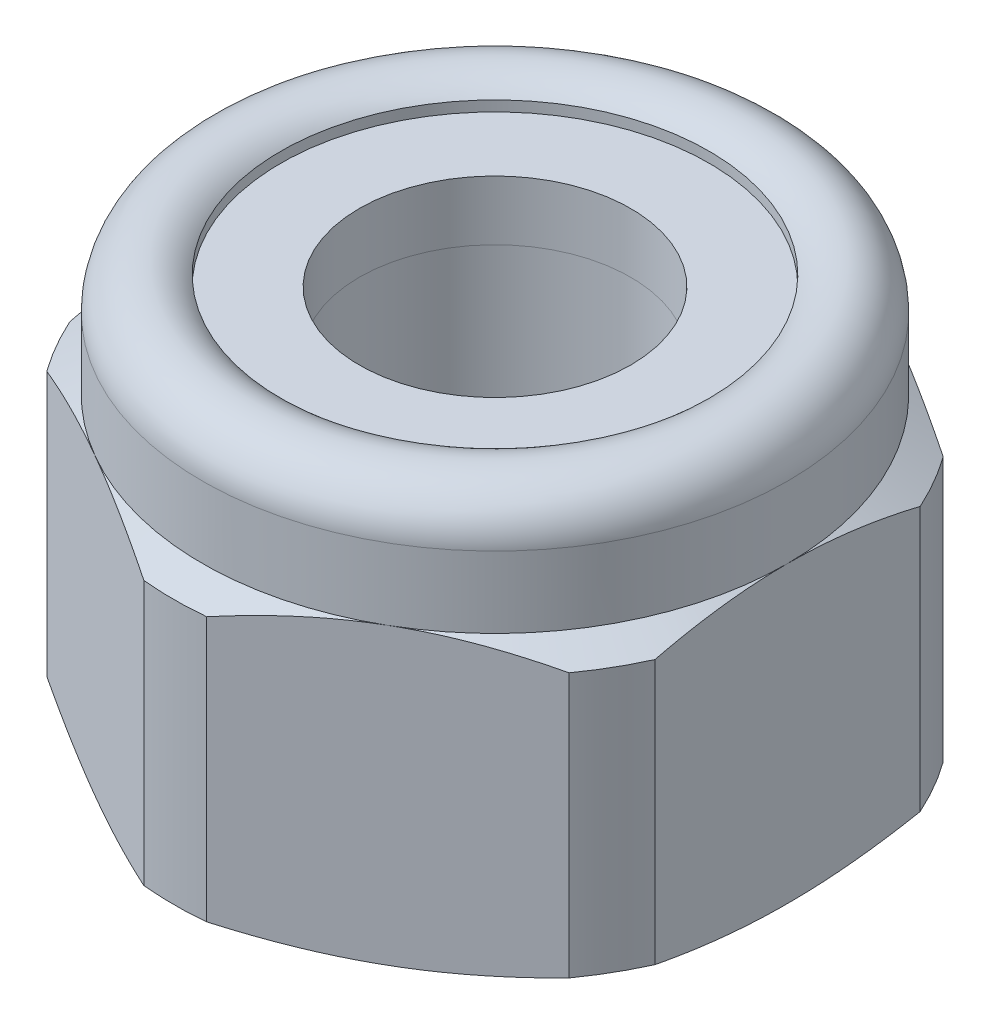
from build123d import *

# Parameters (mm, degrees)
BOSS_EXTRUDE1_DEPTH      = 3.9751
BOSS_EXTRUDE1_DEPTH_BACK = 3.9751
SKETCH2_R                = 2.585793431
SKETCH4_W                = 1.494753284
SKETCH4_H                = 1.134825881
SKETCH11_OUTSIDE_W       = 16.91
SKETCH11_OUTSIDE_H       = 18.636
SKETCH11_OUTSIDE_R       = 6.1214
CUT_EXTRUDE1_DEPTH       = 12.650534115


with BuildPart() as part:
    # Sketch2 → Boss-Extrude1 (new, two sides: drawn at the far end of the back side and taken through both)
    with BuildSketch(Plane(origin=(0, 0, 0), x_dir=(1, 0, 0), z_dir=(0, 1, 0)).offset(-BOSS_EXTRUDE1_DEPTH_BACK)):
        Polygon((0, 6.437801912), (-5.5753, 3.218900956), (-5.5753, -3.218900956), (0, -6.437801912), (5.5753, -3.218900956), (5.5753, 3.218900956), align=None)
        with Locations(Location((0, 0, 0), (0, 0, 270))):
            Circle(SKETCH2_R, mode=Mode.SUBTRACT)
    extrude(amount=BOSS_EXTRUDE1_DEPTH + BOSS_EXTRUDE1_DEPTH_BACK)

    # Sketch3 → Cut-Revolve2 (revolve, cut)
    with BuildSketch(Plane(origin=(0, 0, 0), x_dir=(0, 0, -1), z_dir=(1, 0, 0)), mode=Mode.PRIVATE) as cut_revolve2_sk:
        with BuildLine():
            Line((6.437801912, 1.7399), (6.437801912, 4.9751))
            Line((6.437801912, 4.9751), (2.585793431, 4.9751))
            Line((2.585793431, 4.9751), (2.585793431, 2.38506))
            Line((2.585793431, 2.38506), (4.080546715, 2.38506))
            Line((4.080546715, 2.38506), (4.080546715, 3.718640881))
            ThreePointArc((4.080546715, 3.718640881), (5.034773785, 3.908448447), (5.5753, 3.099493798))
            Line((5.5753, 3.099493798), (5.5753, 1.7399))
            Line((5.5753, 1.7399), (6.437801912, 1.23371655))
            Line((6.437801912, 1.23371655), (6.437801912, 1.7399))
        make_face()
        Polygon((5.352288, -3.9751), (6.437801912, -3.46891655), (6.437801912, -3.9751), align=None)
        Polygon((2.585793431, -3.9751), (2.585793431, -3.3401), (3.220793431, -3.9751), align=None)
    revolve(cut_revolve2_sk.sketch.rotate(Axis((0, -3.9751, 0), (0, 1, 0)), 270), axis=Axis((0, -3.9751, 0), (0, 1, 0)), mode=Mode.SUBTRACT)

    # Sketch11 outside → Cut-Extrude1 (cut, through all)
    with BuildSketch(Plane.XZ.offset(3.9751)):
        Rectangle(SKETCH11_OUTSIDE_W, SKETCH11_OUTSIDE_H)
        Circle(SKETCH11_OUTSIDE_R, mode=Mode.SUBTRACT)
    extrude(amount=-CUT_EXTRUDE1_DEPTH, mode=Mode.SUBTRACT)


with BuildPart() as body_2:
    # Sketch4 → Revolve1 (revolve)
    with BuildSketch(Plane(origin=(0, 0, 0), x_dir=(0, 0, -1), z_dir=(1, 0, 0)), mode=Mode.PRIVATE) as revolve1_sk:
        with Locations((-3.333170073, 2.952472941)):
            Rectangle(SKETCH4_W, SKETCH4_H)
    revolve(revolve1_sk.sketch.rotate(Axis((0, -3.9751, 0), (0, 1, 0)), 90), axis=Axis((0, -3.9751, 0), (0, 1, 0)))


solid = Compound([part.part, body_2.part])
